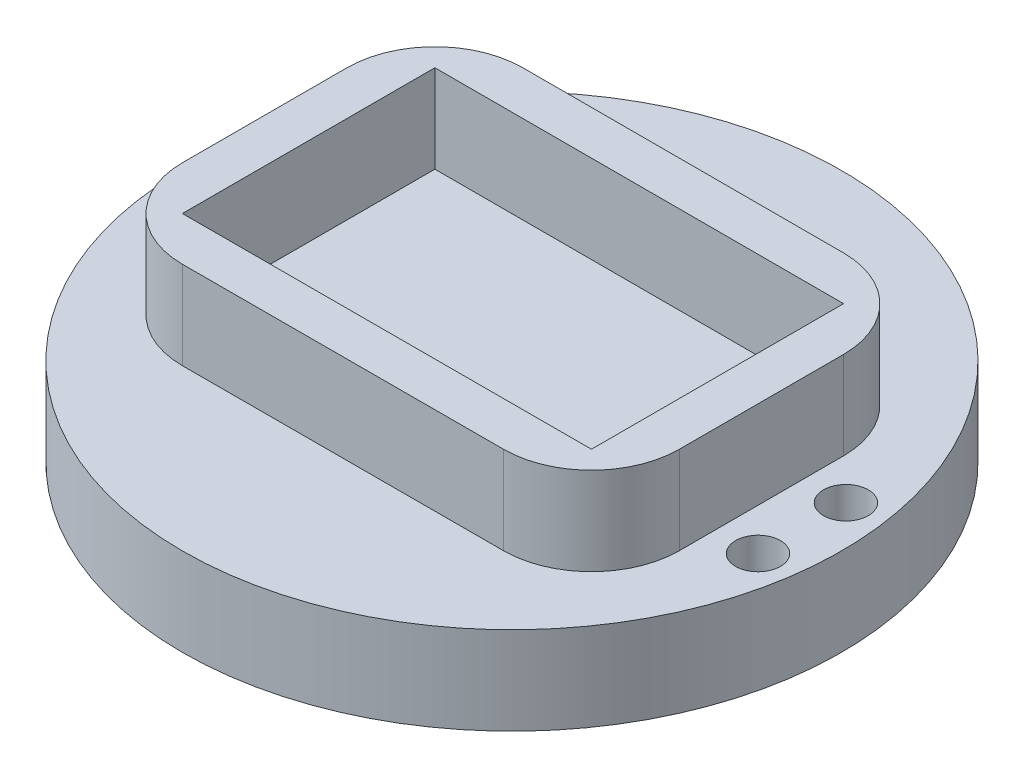
from build123d import *

# Parameters (mm, degrees)
SKETCH1_R           = 37.5
BOSS_EXTRUDE1_DEPTH = 10
BOSS_EXTRUDE2_START = 10
BOSS_EXTRUDE2_DEPTH = 10
SKETCH3_R           = 2.55
CUT_EXTRUDE1_DEPTH  = 10


with BuildPart() as part:
    # Sketch1 → Boss-Extrude1 (new body)
    with BuildSketch(Plane(origin=(0, 0, 0), x_dir=(1, 0, 0), z_dir=(0, 1, 0))):
        with Locations(Location((11.945516858, 0, 0), (0, 0, 270))):
            Circle(SKETCH1_R)
    extrude(amount=BOSS_EXTRUDE1_DEPTH)

    # Sketch2 → Boss-Extrude2 (add)
    with BuildSketch(Plane(origin=(0, 0, 0), x_dir=(1, 0, 0), z_dir=(0, 1, 0)).offset(BOSS_EXTRUDE2_START)):
        with BuildLine():
            Line((-6.304483142, 19.484324941), (30.195516858, 19.484324941))
            ThreePointArc((30.195516858, 19.484324941), (37.26658467, 16.555392753), (40.195516858, 9.484324941))
            Line((40.195516858, 9.484324941), (40.195516858, -9.205373472))
            ThreePointArc((40.195516858, -9.205373472), (37.270385296, -16.272638614), (30.20626954, -19.205367691))
            Line((30.20626954, -19.205367691), (-6.29373046, -19.244615001))
            ThreePointArc((-6.29373046, -19.244615001), (-13.371748284, -16.319489219), (-16.304483142, -9.244620782))
            Line((-16.304483142, -9.244620782), (-16.304483142, 9.484324941))
            ThreePointArc((-16.304483142, 9.484324941), (-13.375550954, 16.555392753), (-6.304483142, 19.484324941))
        make_face()
        Polygon((-11.304483142, -14.250000016), (35.195516858, -14.200000018), (35.195516858, 14.484324941), (-11.304483142, 14.484324941), align=None, mode=Mode.SUBTRACT)
    extrude(amount=BOSS_EXTRUDE2_DEPTH)

    # Sketch3 → Cut-Extrude1 (cut)
    with BuildSketch(Plane(origin=(0, 10, 0), x_dir=(1, 0, 0), z_dir=(0, 1, 0))):
        with Locations(Location((-21.054483142, -5, 0), (0, 0, 270))):
            Circle(SKETCH3_R)
        with Locations(Location((-21.054483142, 5, 0), (0, 0, 90))):
            Circle(SKETCH3_R)
        with Locations(Location((44.945516858, -5, 0), (0, 0, 90))):
            Circle(SKETCH3_R)
        with Locations(Location((44.945516858, 5, 0), (0, 0, 270))):
            Circle(SKETCH3_R)
    extrude(amount=-CUT_EXTRUDE1_DEPTH, mode=Mode.SUBTRACT)


solid = part.part
